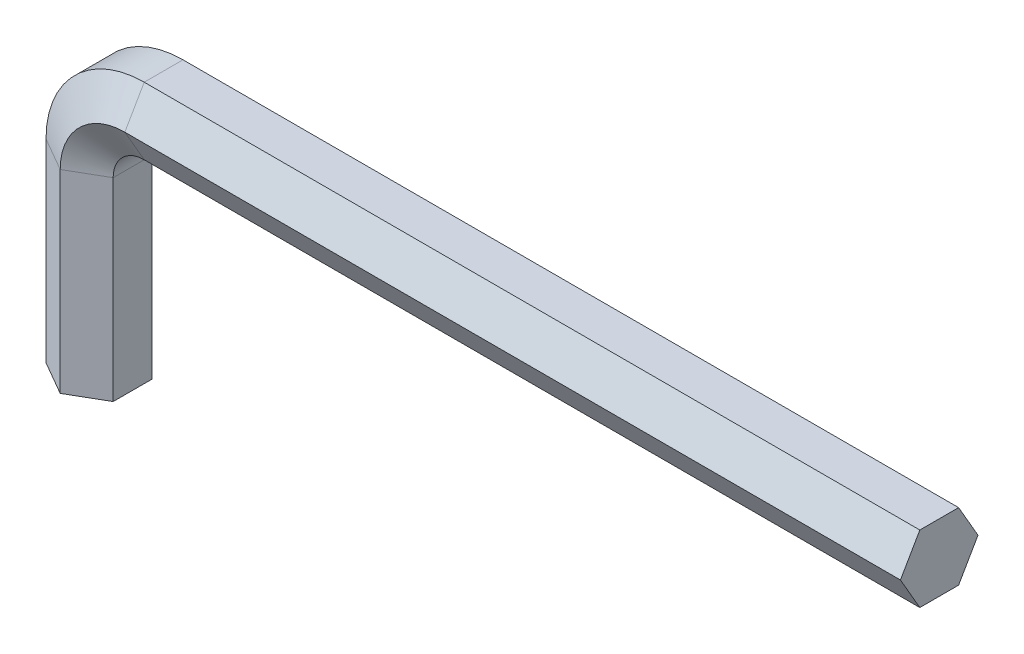
from build123d import *


with BuildPart() as part:
    # Sweep1: sweep along a path in Sketch1
    with BuildLine(Plane.XY) as sweep1_path:
        Line((65, 0), (5, 0))
        ThreePointArc((5, 0), (1.464466094, -1.464466094), (0, -5))
        Line((0, -5), (0, -20))
    # Sketch2 → Sweep1 (sweep)
    with BuildSketch(Plane(origin=(0, -20, 0), x_dir=(-1, 0, 0), z_dir=(0, -1, 0))):
        Polygon((0, 3), (-2.598076211, 1.5), (-2.598076211, -1.5), (0, -3), (2.598076211, -1.5), (2.598076211, 1.5), align=None)
    sweep(path=sweep1_path.line)


solid = part.part
